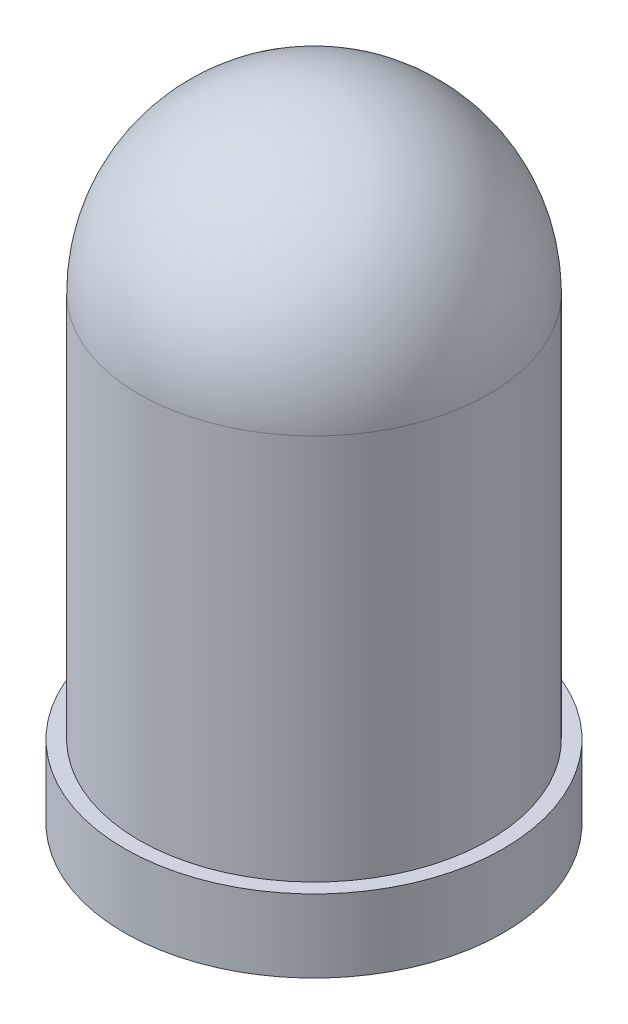
from build123d import *

# Parameters (mm, degrees)
SKETCH1_R           = 2.4
BOSS_EXTRUDE1_DEPTH = 8.7
FILLET1_R           = 2.4
SKETCH2_R           = 2.6
BOSS_EXTRUDE2_DEPTH = 1


with BuildPart() as part:
    # Sketch1 → Boss-Extrude1 (new body)
    with BuildSketch(Plane(origin=(0, 0, 0), x_dir=(1, 0, 0), z_dir=(0, 1, 0))):
        with Locations(Location((0, 0, 0), (0, 0, 270))):
            Circle(SKETCH1_R)
    extrude(amount=BOSS_EXTRUDE1_DEPTH)

    # Fillet1
    fillet1_edges = [part.edges().sort_by_distance(p)[0] for p in [
        (0, 8.7, -2.4),
    ]]
    fillet(fillet1_edges, radius=FILLET1_R)

    # Sketch2 → Boss-Extrude2 (add)
    with BuildSketch(Plane(origin=(0, 0, 0), x_dir=(1, 0, 0), z_dir=(0, 1, 0))):
        with Locations(Location((0, 0, 0), (0, 0, 270))):
            Circle(SKETCH2_R)
    extrude(amount=BOSS_EXTRUDE2_DEPTH)


solid = part.part
